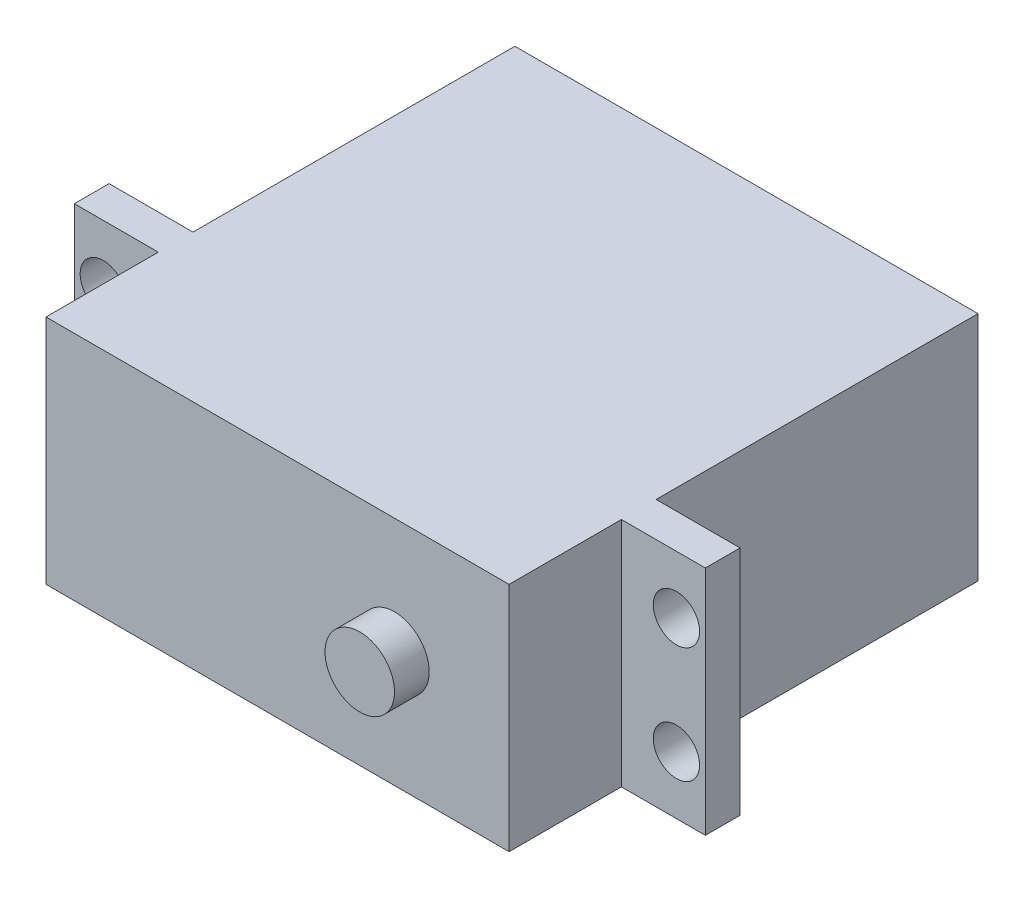
from build123d import *

# Parameters (mm, degrees)
SKETCH_1_W          = 40
SKETCH_1_H          = 20
EXTRUDE_1_DEPTH     = 40.5
SKETCH_2_W          = 7.25
SKETCH_2_H          = 20
EXTRUDE_2_DEPTH     = 3
SKETCH_3_R          = 2
CUT_EXTRUDE_1_DEPTH = 5
SKETCH_4_R          = 3
EXTRUDE_3_DEPTH     = 3


with BuildPart() as part:
    # 草图1 → 凸台-拉伸1 (new body)
    with BuildSketch(Plane.XY):
        Rectangle(SKETCH_1_W, SKETCH_1_H)
    extrude(amount=EXTRUDE_1_DEPTH)

    # 草图2 → 凸台-拉伸2 (add)
    with BuildSketch(Plane(origin=(0, 0, 27.8), x_dir=(-1, 0, 0), z_dir=(0, 0, -1))):
        with Locations((-23.625, 0)):
            Rectangle(SKETCH_2_W, SKETCH_2_H)
        with Locations((23.625, 0)):
            Rectangle(SKETCH_2_W, SKETCH_2_H)
    extrude(amount=-EXTRUDE_2_DEPTH)

    # 草图3 → 切除-拉伸1 (cut)
    with BuildSketch(Plane.XY.offset(30.8)):
        with Locations((-24.75, 5)):
            Circle(SKETCH_3_R)
        with Locations((-24.75, -5)):
            Circle(SKETCH_3_R)
        with Locations(Location((24.75, -5, 0), (0, 0, 180))):
            Circle(SKETCH_3_R)
        with Locations(Location((24.75, 5, 0), (0, 0, 180))):
            Circle(SKETCH_3_R)
    extrude(amount=-CUT_EXTRUDE_1_DEPTH, mode=Mode.SUBTRACT)

    # 草图4 → 凸台-拉伸3 (add)
    with BuildSketch(Plane.XY.offset(40.5)):
        with Locations((10.1, 0)):
            Circle(SKETCH_4_R)
    extrude(amount=EXTRUDE_3_DEPTH)


solid = part.part
